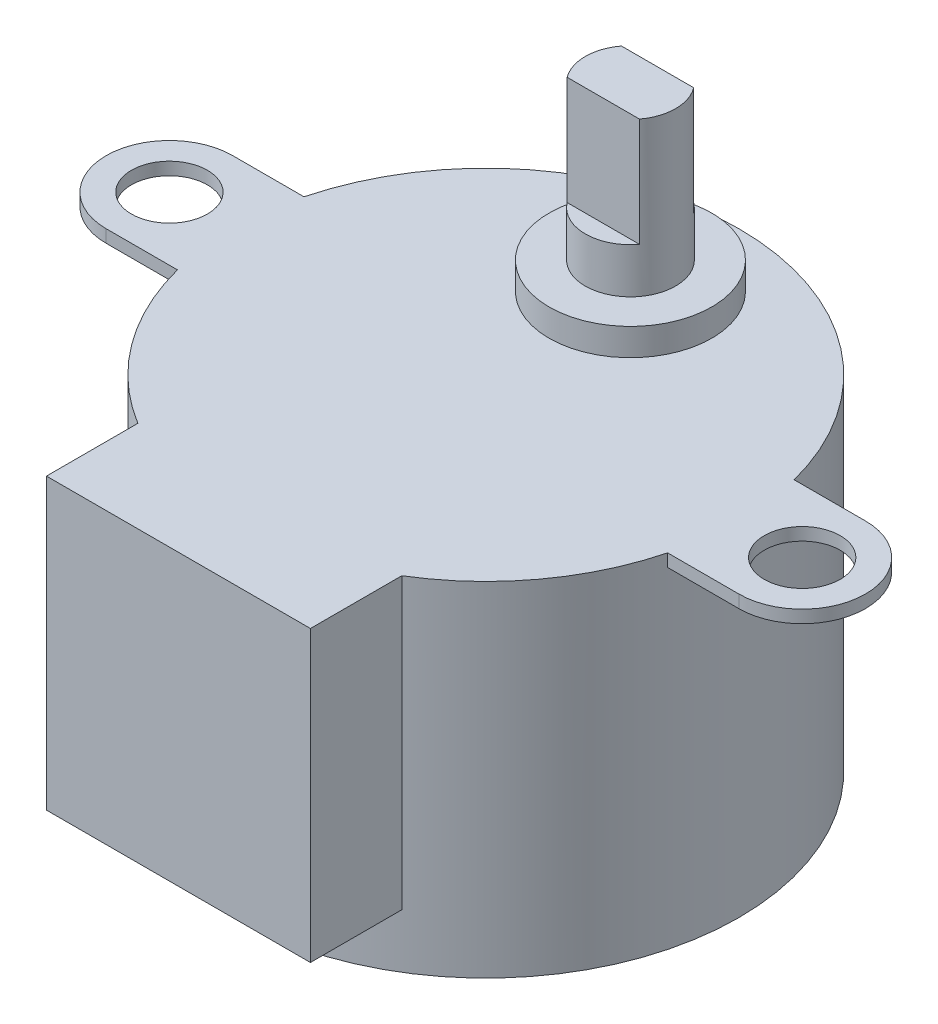
from build123d import *

# Parameters (mm, degrees)
SKETCH1_R           = 14
BOSS_EXTRUDE2_DEPTH = 19
BOSS_EXTRUDE4_START = -0.7
SKETCH2_R           = 2.1
BOSS_EXTRUDE4_DEPTH = 0.7
BOSS_EXTRUDE5_START = -16
BOSS_EXTRUDE5_DEPTH = 16
SKETCH4_R           = 4.5
BOSS_EXTRUDE6_DEPTH = 1.5
SKETCH5_R           = 2.5
BOSS_EXTRUDE7_DEPTH = 8.5
CUT_EXTRUDE1_START  = -6
CUT_EXTRUDE1_DEPTH  = 6


with BuildPart() as part:
    # Sketch1 → Boss-Extrude2 (new body)
    with BuildSketch(Plane(origin=(0, 0, 0), x_dir=(1, 0, 0), z_dir=(0, 1, 0))):
        with Locations(Location((0, 0, 0), (0, 0, 270))):
            Circle(SKETCH1_R)
    extrude(amount=BOSS_EXTRUDE2_DEPTH)

    # Sketch2 → Boss-Extrude4 (add)
    # profile 1 of 2: a face of its own
    with BuildSketch(Plane(origin=(0, 19, 0), x_dir=(1, 0, 0), z_dir=(0, 1, 0)).offset(BOSS_EXTRUDE4_START)):
        with BuildLine():
            Line((17.5, 3.5), (13.555441712, 3.5))
            ThreePointArc((13.555441712, 3.5), (13.888415748, 1.764060095), (14, 0))
            ThreePointArc((14, 0), (13.888415748, -1.764060095), (13.555441712, -3.5))
            Line((13.555441712, -3.5), (17.5, -3.5))
            ThreePointArc((17.5, -3.5), (21, 0), (17.5, 3.5))
        make_face()
        with Locations(Location((17.5, 0, 0), (0, 0, 270))):
            Circle(SKETCH2_R, mode=Mode.SUBTRACT)
    # profile 2 of 2: a face of its own
    with BuildSketch(Plane(origin=(0, 19, 0), x_dir=(1, 0, 0), z_dir=(0, 1, 0)).offset(BOSS_EXTRUDE4_START)):
        with BuildLine():
            Line((-13.555441712, 3.5), (-17.5, 3.5))
            ThreePointArc((-17.5, 3.5), (-21, 0), (-17.5, -3.5))
            Line((-17.5, -3.5), (-13.555441712, -3.5))
            ThreePointArc((-13.555441712, -3.5), (-14, 0), (-13.555441712, 3.5))
        make_face()
        with Locations(Location((-17.5, 0, 0), (0, 0, 270))):
            Circle(SKETCH2_R, mode=Mode.SUBTRACT)
    extrude(amount=BOSS_EXTRUDE4_DEPTH)

    # Sketch3 → Boss-Extrude5 (add)
    with BuildSketch(Plane(origin=(0, 19, 0), x_dir=(1, 0, 0), z_dir=(0, 1, 0)).offset(BOSS_EXTRUDE5_START)):
        with BuildLine():
            Line((-7.3, -11.94612908), (-7.3, -17))
            Line((-7.3, -17), (7.3, -17))
            Line((7.3, -17), (7.3, -11.94612908))
            ThreePointArc((7.3, -11.94612908), (0, -14), (-7.3, -11.94612908))
        make_face()
    extrude(amount=BOSS_EXTRUDE5_DEPTH)

    # Sketch4 → Boss-Extrude6 (add)
    with BuildSketch(Plane(origin=(0, 19, 0), x_dir=(1, 0, 0), z_dir=(0, 1, 0))):
        with Locations(Location((0, 8, 0), (0, 0, 270))):
            Circle(SKETCH4_R)
    extrude(amount=BOSS_EXTRUDE6_DEPTH)

    # Sketch5 → Boss-Extrude7 (add)
    with BuildSketch(Plane(origin=(0, 20.5, 0), x_dir=(1, 0, 0), z_dir=(0, 1, 0))):
        with Locations(Location((0, 8, 0), (0, 0, 270))):
            Circle(SKETCH5_R)
    extrude(amount=BOSS_EXTRUDE7_DEPTH)

    # Sketch7 → Cut-Extrude1 (cut)
    with BuildSketch(Plane(origin=(0, 29, 0), x_dir=(1, 0, 0), z_dir=(0, 1, 0)).offset(CUT_EXTRUDE1_START)):
        with BuildLine():
            Line((-2, 9.5), (2, 9.5))
            ThreePointArc((2, 9.5), (0, 10.5), (-2, 9.5))
        make_face()
        with BuildLine():
            Line((-2, 6.5), (2, 6.5))
            ThreePointArc((2, 6.5), (0, 5.5), (-2, 6.5))
        make_face()
    extrude(amount=CUT_EXTRUDE1_DEPTH, mode=Mode.SUBTRACT)


solid = part.part
